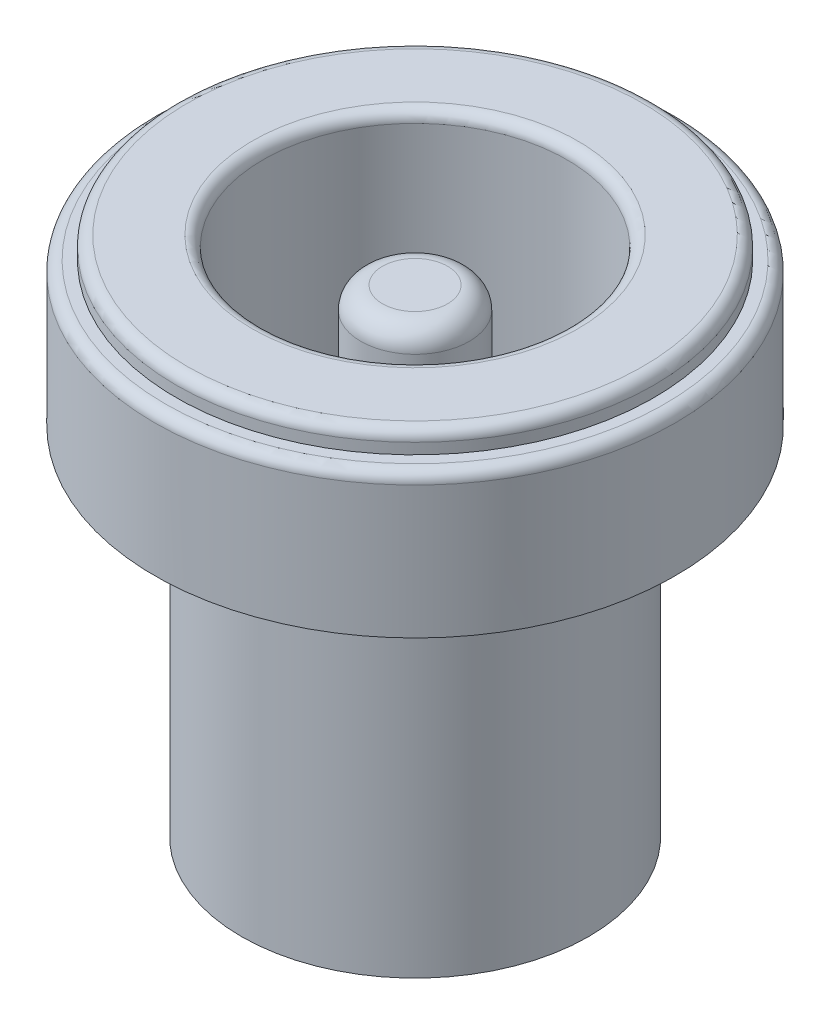
from build123d import *

# Parameters (mm, degrees)
SKETCH2_R            = 3.5
SKETCH2_R_2          = 1.25
INSIDE_CUT_DEPTH     = 10
SKETCH3_R            = 1.25
PIN_SHORTENING_DEPTH = 1
FILLET1_R            = 0.5
FILLET2_R            = 0.25


with BuildPart() as part:
    # Sketch1 → BULK (revolve)
    with BuildSketch(Plane.XY, mode=Mode.PRIVATE) as bulk_sk:
        Polygon((0, 0), (5.5, 0), (5.5, -0.5), (6, -0.5), (6, -3.8), (4, -3.8), (4, -12), (0, -12), align=None)
    revolve(bulk_sk.sketch.rotate(Axis((0, -12, 0), (0, 1, 0)), 90), axis=Axis((0, -12, 0), (0, 1, 0)))

    # Sketch2 → INSIDE CUT (cut)
    with BuildSketch(Plane(origin=(0, 0, 0), x_dir=(1, 0, 0), z_dir=(0, 1, 0))):
        with Locations(Location((0, 0, 0), (0, 0, 270))):
            Circle(SKETCH2_R)
        with Locations(Location((0, 0, 0), (0, 0, 270))):
            Circle(SKETCH2_R_2, mode=Mode.SUBTRACT)
    extrude(amount=-INSIDE_CUT_DEPTH, mode=Mode.SUBTRACT)

    # Sketch3 → PIN SHORTENING (cut)
    with BuildSketch(Plane(origin=(0, 0, 0), x_dir=(1, 0, 0), z_dir=(0, 1, 0))):
        with Locations(Location((0, 0, 0), (0, 0, 270))):
            Circle(SKETCH3_R)
    extrude(amount=-PIN_SHORTENING_DEPTH, mode=Mode.SUBTRACT)

    # Fillet1
    fillet1_edges = [part.edges().sort_by_distance(p)[0] for p in [
        (0, -1, -1.25),
    ]]
    fillet(fillet1_edges, radius=FILLET1_R)

    # Fillet2
    fillet2_edges = [part.edges().sort_by_distance(p)[0] for p in [
        (0, -10, -3.5),
        (0, 0, -3.5),
        (0, -0.5, 6),
        (0, 0, 5.5),
    ]]
    fillet(fillet2_edges, radius=FILLET2_R)


solid = part.part
